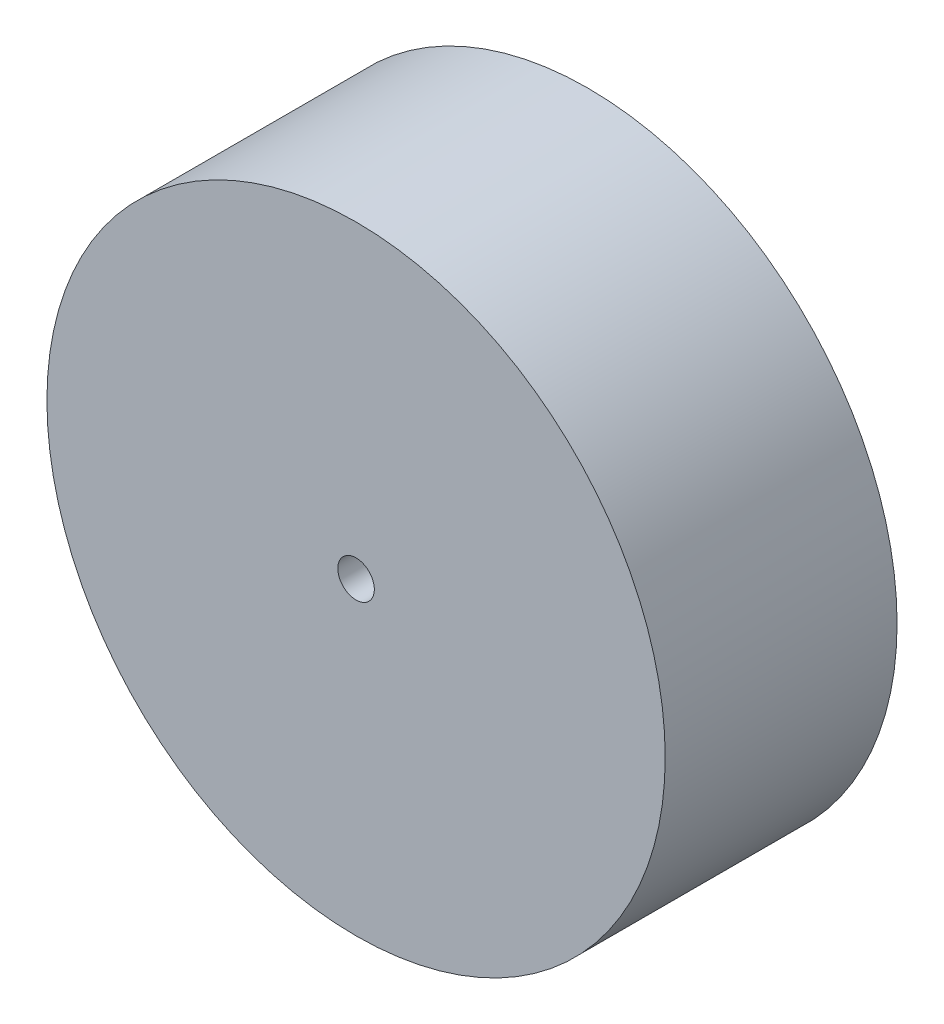
from build123d import *

# Parameters (mm, degrees)
SKETCH4_R           = 25.4
BOSS_EXTRUDE4_DEPTH = 19.05
SKETCH6_R           = 1.5
CUT_EXTRUDE1_DEPTH  = 19.05


with BuildPart() as part:
    # Sketch4 → Boss-Extrude4 (new body)
    with BuildSketch(Plane.XY):
        with Locations(Location((0, 0, 0), (0, 0, 180))):
            Circle(SKETCH4_R)
    extrude(amount=BOSS_EXTRUDE4_DEPTH)

    # Sketch6 → Cut-Extrude1 (cut)
    with BuildSketch(Plane(origin=(0, 0, 0), x_dir=(-1, 0, 0), z_dir=(0, 0, -1))):
        Circle(SKETCH6_R)
    extrude(amount=-CUT_EXTRUDE1_DEPTH, mode=Mode.SUBTRACT)


solid = part.part
